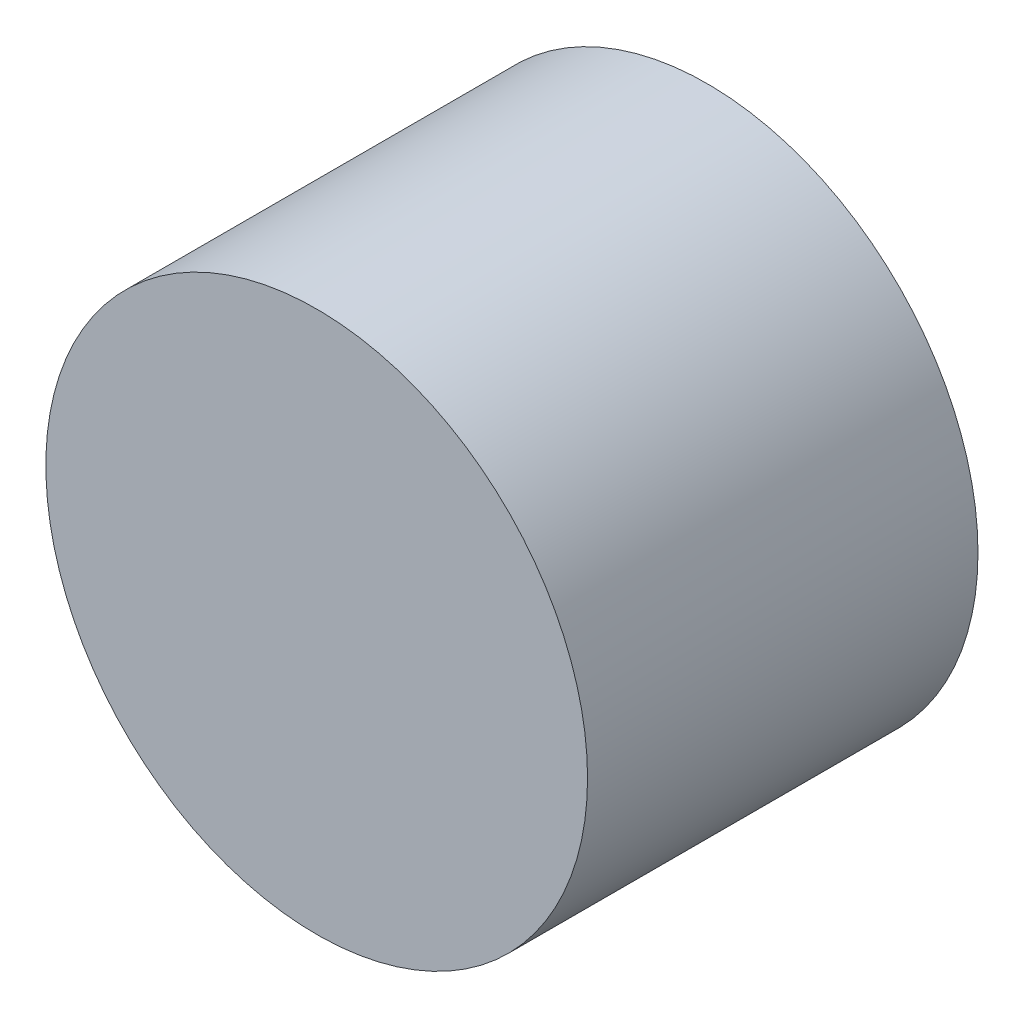
from build123d import *

# Parameters (mm, degrees)
SKETCH1_R           = 1.3875
BOSS_EXTRUDE1_DEPTH = 2


with BuildPart() as part:
    # Sketch1 → Boss-Extrude1 (new body)
    with BuildSketch(Plane.XY):
        Circle(SKETCH1_R)
    extrude(amount=BOSS_EXTRUDE1_DEPTH)


solid = part.part
